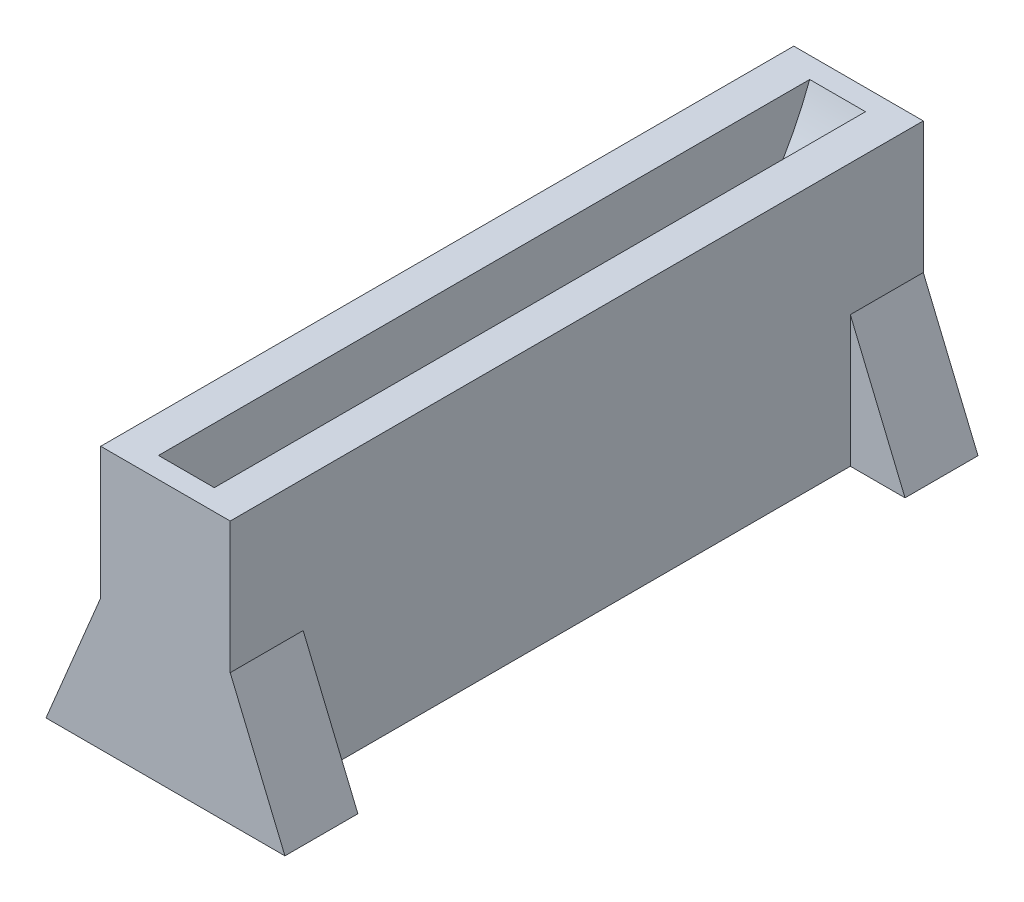
from build123d import *

# Parameters (mm, degrees)
SKETCH1_W                = 35.5
SKETCH1_H                = 190
BOSS_EXTRUDE1_DEPTH      = 72
CUT_EXTRUDE15_DEPTH      = 7.65
CUT_EXTRUDE15_DEPTH_BACK = 7.65
SKETCH2_R                = 95.25
BOSS_EXTRUDE5_DEPTH      = 95
BOSS_EXTRUDE5_DEPTH_BACK = 95
SKETCH7_W                = 41.37003368
SKETCH7_H                = 150
CUT_EXTRUDE16_DEPTH      = 45
SKETCH8_W                = 72.584654809
SKETCH8_H                = 150
CUT_EXTRUDE17_DEPTH      = 45


with BuildPart() as part:
    # Sketch1 → Boss-Extrude1 (new body)
    with BuildSketch(Plane(origin=(0, 0, 0), x_dir=(1, 0, 0), z_dir=(0, 1, 0))):
        Rectangle(SKETCH1_W, SKETCH1_H)
    extrude(amount=BOSS_EXTRUDE1_DEPTH)

    # Sketch2 → Cut-Extrude15 (cut, two sides: drawn at the far end of the back side and taken through both)
    with BuildSketch(Plane(origin=(0, 0, 0), x_dir=(0, 0, -1), z_dir=(1, 0, 0)).offset(-CUT_EXTRUDE15_DEPTH_BACK)):
        with Locations((0, 105.25)):
            Circle(SKETCH2_R)
    extrude(amount=CUT_EXTRUDE15_DEPTH + CUT_EXTRUDE15_DEPTH_BACK, mode=Mode.SUBTRACT)

    # Sketch6 → Boss-Extrude5 (add, two sides: drawn at the far end of the back side and taken through both)
    with BuildSketch(Plane.XY.offset(-BOSS_EXTRUDE5_DEPTH_BACK)):
        Polygon((-17.75, 0), (-32.75, 0), (-17.75, 36), align=None)
        Polygon((17.75, 0), (32.75, 0), (17.75, 36), align=None)
    extrude(amount=BOSS_EXTRUDE5_DEPTH + BOSS_EXTRUDE5_DEPTH_BACK)

    # Sketch7 → Cut-Extrude16 (cut)
    with BuildSketch(Plane(origin=(0, 0, 0), x_dir=(1, 0, 0), z_dir=(0, 1, 0))):
        with Locations((-38.43501684, 0)):
            Rectangle(SKETCH7_W, SKETCH7_H)
    extrude(amount=CUT_EXTRUDE16_DEPTH, mode=Mode.SUBTRACT)

    # Sketch8 → Cut-Extrude17 (cut)
    with BuildSketch(Plane(origin=(0, 0, 0), x_dir=(1, 0, 0), z_dir=(0, 1, 0))):
        with Locations((54.042327404, 0)):
            Rectangle(SKETCH8_W, SKETCH8_H)
    extrude(amount=CUT_EXTRUDE17_DEPTH, mode=Mode.SUBTRACT)


solid = part.part
